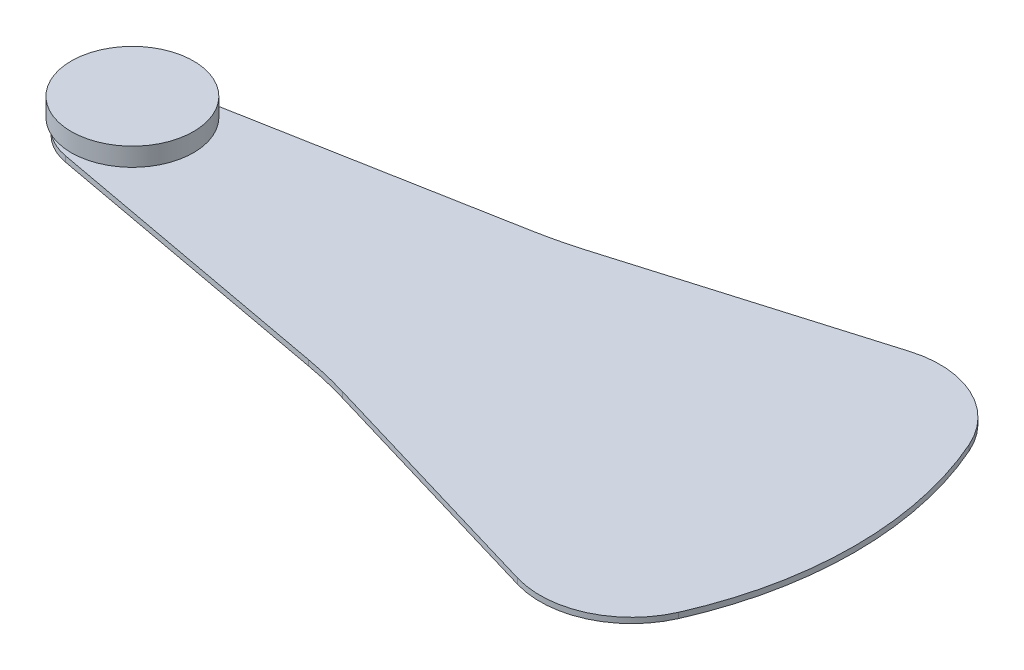
from build123d import *

# Parameters (mm, degrees)
BOSS_EXTRUDE2_DEPTH = 0.18
SKETCH4_R           = 1
CUT_EXTRUDE1_DEPTH  = 117.645463897
SKETCH7_R           = 2
BOSS_EXTRUDE3_DEPTH = 0.6
BOSS_EXTRUDE4_REACH = 118.649
SKETCH8_R           = 1.4
SKETCH8_R_2         = 1


with BuildPart() as part:
    # Sketch2 → Boss-Extrude2 (new body)
    with BuildSketch(Plane.XZ.offset(-113.480952772)):
        with BuildLine():
            Line((60.372883835, 72.194540047), (70.125446667, 70.394451024))
            ThreePointArc((70.125446667, 70.394451024), (70.859385482, 70.238798062), (71.58406324, 70.044540047))
            Line((71.58406324, 70.044540047), (79.733100179, 67.627269484))
            ThreePointArc((79.733100179, 67.627269484), (81.847875106, 67.781237193), (83.333100179, 69.294540047))
            ThreePointArc((83.333100179, 69.294540047), (84.080389833, 71.617479067), (84.333100179, 74.044540047))
            ThreePointArc((84.333100179, 74.044540047), (84.080389833, 76.471601027), (83.333100179, 78.794540047))
            ThreePointArc((83.333100179, 78.794540047), (81.847875106, 80.307842901), (79.733100179, 80.46181061))
            Line((79.733100179, 80.46181061), (71.58406324, 78.044540047))
            ThreePointArc((71.58406324, 78.044540047), (70.859385482, 77.850282031), (70.125446667, 77.69462907))
            Line((70.125446667, 77.69462907), (60.372883835, 75.894540047))
            ThreePointArc((60.372883835, 75.894540047), (58.833100179, 74.044540047), (60.372883835, 72.194540047))
        make_face()
    extrude(amount=-BOSS_EXTRUDE2_DEPTH)

    # Sketch4 → Cut-Extrude1 (cut, through all)
    with BuildSketch(Plane.XZ.offset(-113.480952772)):
        with Locations(Location((60.714349432, 74.044540047, 0), (0, 0, 270))):
            Circle(SKETCH4_R)
    extrude(amount=-CUT_EXTRUDE1_DEPTH, mode=Mode.SUBTRACT)


with BuildPart() as body_2:
    # Sketch7 → Boss-Extrude3 (new body)
    with BuildSketch(Plane(origin=(0, 113.990952772, 0), x_dir=(1, 0, 0), z_dir=(0, 1, 0))):
        with Locations(Location((60.714349432, -74.044540047, 0), (0, 0, 270))):
            Circle(SKETCH7_R)
    extrude(amount=BOSS_EXTRUDE3_DEPTH)

    # Sketch8 → Boss-Extrude4 (add, up to next)
    with BuildSketch(Plane(origin=(0, 113.660952772, 0), x_dir=(1, 0, 0), z_dir=(0, 1, 0)), mode=Mode.PRIVATE) as boss_extrude4_sk1:
        with Locations(Location((60.714349432, -74.044540047, 0), (0, 0, 270))):
            Circle(SKETCH8_R)
        with Locations(Location((60.714349432, -74.044540047, 0), (0, 0, 90))):
            Circle(SKETCH8_R_2, mode=Mode.SUBTRACT)
    boss_extrude4_tool1 = extrude(boss_extrude4_sk1.sketch, amount=BOSS_EXTRUDE4_REACH, mode=Mode.PRIVATE) - body_2.part

    add(part.part)  # Boss-Extrude4 merges part
    add(boss_extrude4_tool1.solids().sort_by_distance((60.714349, 113.660953, 72.684138))[0])


solid = body_2.part
